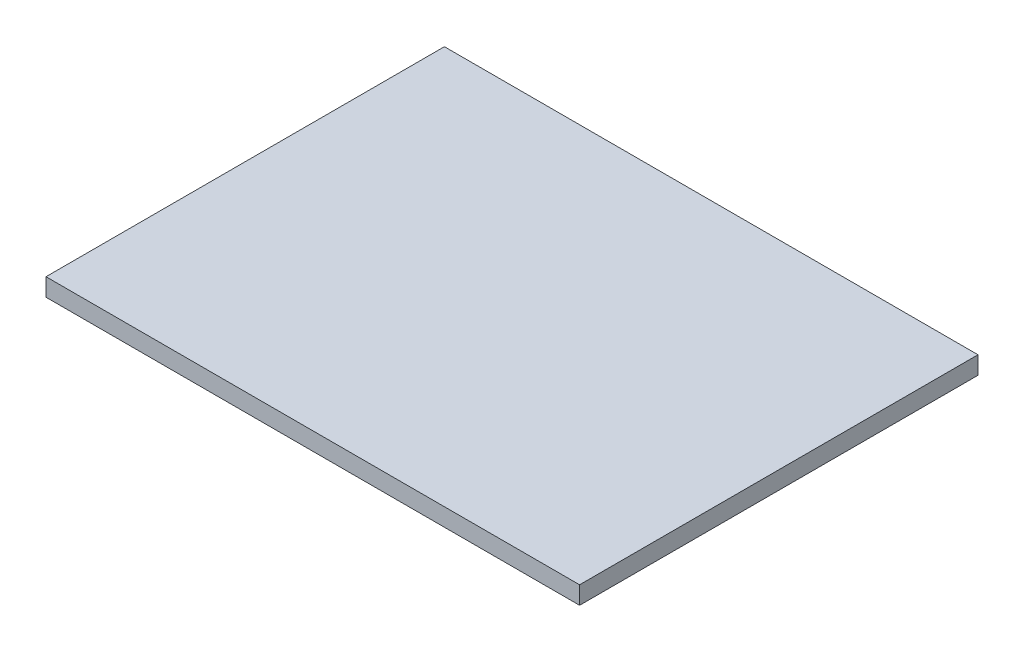
from build123d import *

# Parameters (mm, degrees)
SKETCH_2_W      = 300
SKETCH_2_H      = 224
EXTRUDE_1_DEPTH = 10


with BuildPart() as part:
    # 草图2 → 凸台-拉伸1 (new body)
    with BuildSketch(Plane(origin=(0, 0, 0), x_dir=(1, 0, 0), z_dir=(0, 1, 0))):
        Rectangle(SKETCH_2_W, SKETCH_2_H)
    extrude(amount=EXTRUDE_1_DEPTH)


solid = part.part
